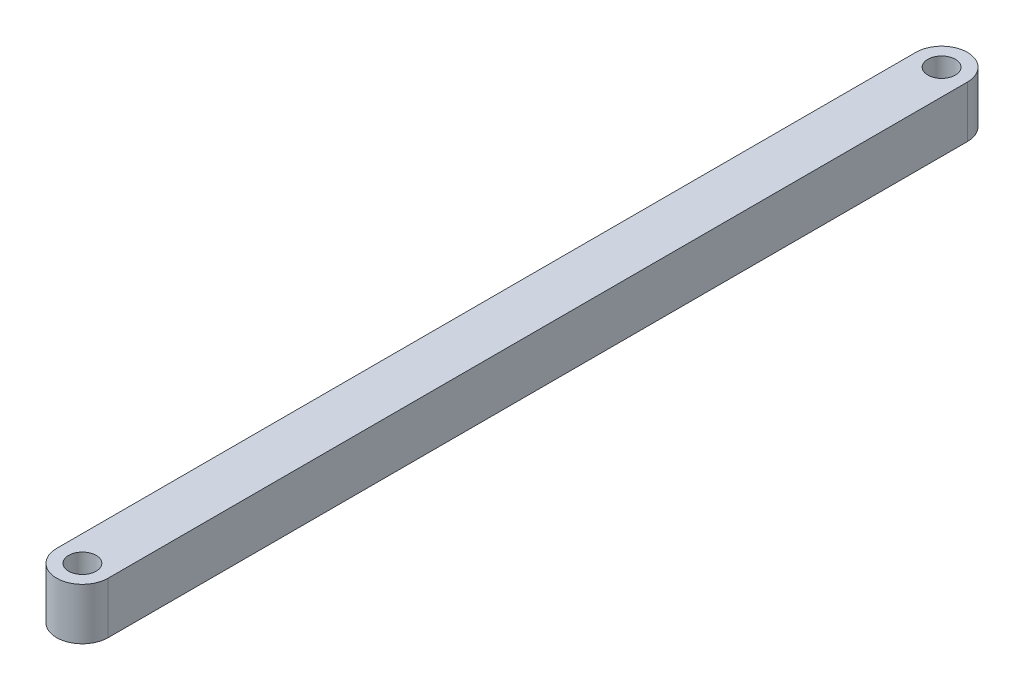
from build123d import *

# Parameters (mm, degrees)
SKETCH_1_R      = 1.6
EXTRUDE_1_DEPTH = 6


with BuildPart() as part:
    # 草图1 → 凸台-拉伸1 (new body)
    with BuildSketch(Plane(origin=(0, 0, 0), x_dir=(1, 0, 0), z_dir=(0, 1, 0))):
        with BuildLine():
            Line((-3, -50), (-3, 50))
            ThreePointArc((-3, 50), (0, 53), (3, 50))
            Line((3, 50), (3, -50))
            ThreePointArc((3, -50), (0, -53), (-3, -50))
        make_face()
        with Locations(Location((0, 50, 0), (0, 0, 270))):
            Circle(SKETCH_1_R, mode=Mode.SUBTRACT)
        with Locations(Location((0, -50, 0), (0, 0, 270))):
            Circle(SKETCH_1_R, mode=Mode.SUBTRACT)
    extrude(amount=EXTRUDE_1_DEPTH)


solid = part.part
